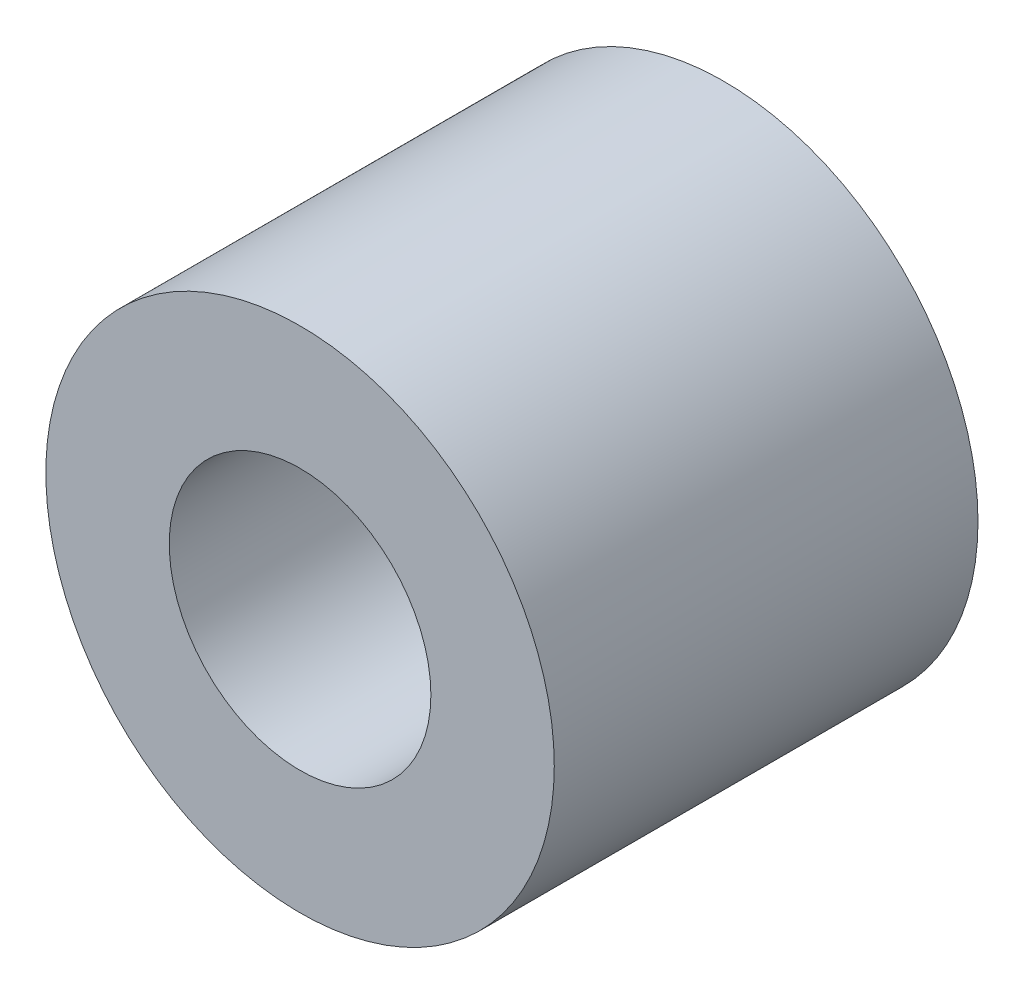
from build123d import *

# Parameters (mm, degrees)
SKETCH1_R      = 6
SKETCH1_R_2    = 3.0875
EXTRUDE1_DEPTH = 5


with BuildPart() as part:
    # Sketch1 → Extrude1 (new, symmetric)
    with BuildSketch(Plane.XY):
        Circle(SKETCH1_R)
        Circle(SKETCH1_R_2, mode=Mode.SUBTRACT)
    extrude(amount=EXTRUDE1_DEPTH, both=True)


solid = part.part
